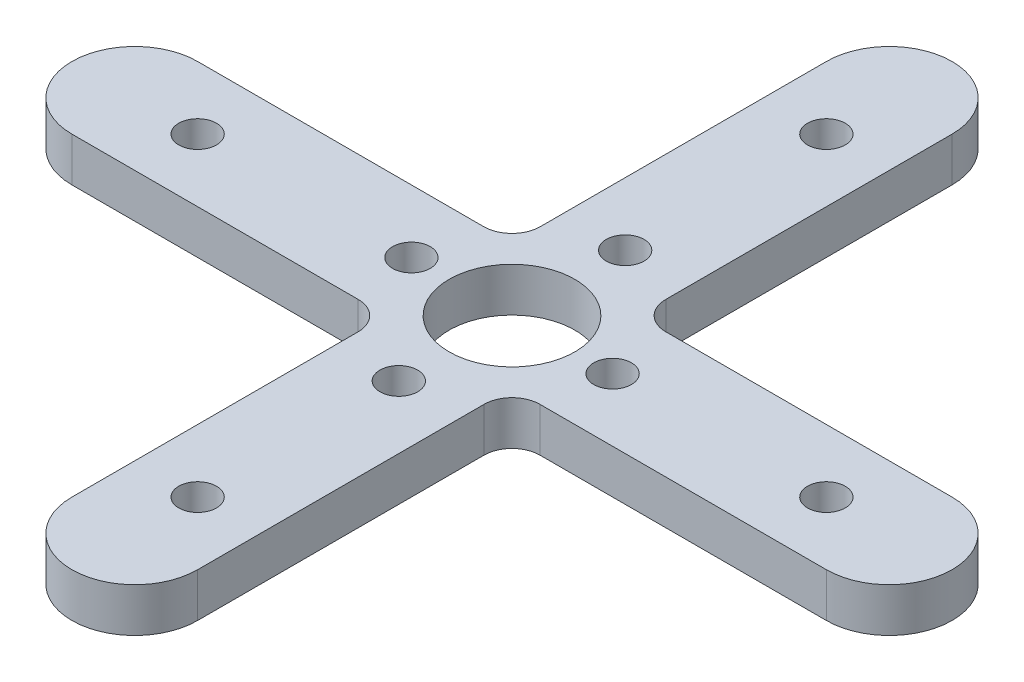
from build123d import *

# Parameters (mm, degrees)
CROQUIS1_R              = 1.5
CROQUIS1_R_2            = 5
SALIENTE_EXTRUIR2_DEPTH = 3.5


with BuildPart() as part:
    # Croquis1 → Saliente-Extruir2 (new body)
    with BuildSketch(Plane(origin=(0, 0, 0), x_dir=(1, 0, 0), z_dir=(0, 1, 0))):
        with BuildLine():
            Line((1.47572532, 11.484579709), (1.47572532, 3.695762793))
            ThreePointArc((1.47572532, 3.695762793), (0.818994747, 2.110274939), (-0.766493108, 1.453544366))
            Line((-0.766493108, 1.453544366), (-23.52427468, 1.453544366))
            ThreePointArc((-23.52427468, 1.453544366), (-28.52427468, -3.546455634), (-23.52427468, -8.546455634))
            Line((-23.52427468, -8.546455634), (-0.766493108, -8.546455634))
            ThreePointArc((-0.766493108, -8.546455634), (0.818994747, -9.203186206), (1.47572532, -10.788674061))
            Line((1.47572532, -10.788674061), (1.47572532, -18.577490976))
            Line((1.47572532, -18.577490976), (1.47572532, -33.546455634))
            ThreePointArc((1.47572532, -33.546455634), (6.47572532, -38.546455634), (11.47572532, -33.546455634))
            Line((11.47572532, -33.546455634), (11.47572532, -10.788674061))
            Line((11.47572532, -10.788674061), (11.47572532, -10.748363891))
            ThreePointArc((11.47572532, -10.748363891), (12.133603326, -9.190173106), (13.697697252, -8.546455634))
            Line((13.697697252, -8.546455634), (36.47572532, -8.546455634))
            ThreePointArc((36.47572532, -8.546455634), (41.47572532, -3.546455634), (36.47572532, 1.453544366))
            Line((36.47572532, 1.453544366), (13.697697252, 1.453544366))
            ThreePointArc((13.697697252, 1.453544366), (12.133603326, 2.097261838), (11.47572532, 3.655452623))
            Line((11.47572532, 3.655452623), (11.47572532, 3.695762793))
            Line((11.47572532, 3.695762793), (11.47572532, 26.453544366))
            ThreePointArc((11.47572532, 26.453544366), (6.47572532, 31.453544366), (1.47572532, 26.453544366))
            Line((1.47572532, 26.453544366), (1.47572532, 11.484579709))
        make_face()
        with Locations(Location((-1.52427468, -3.546455634, 0), (0, 0, 270))):
            Circle(CROQUIS1_R, mode=Mode.SUBTRACT)
        with Locations(Location((6.47572532, -28.546455634, 0), (0, 0, 270))):
            Circle(CROQUIS1_R, mode=Mode.SUBTRACT)
        with Locations(Location((6.47572532, -12.546455634, 0), (0, 0, 270))):
            Circle(CROQUIS1_R, mode=Mode.SUBTRACT)
        with Locations(Location((-18.52427468, -3.546455634, 0), (0, 0, 270))):
            Circle(CROQUIS1_R, mode=Mode.SUBTRACT)
        with Locations(Location((6.47572532, -3.546455634, 0), (0, 0, 270))):
            Circle(CROQUIS1_R_2, mode=Mode.SUBTRACT)
        with Locations(Location((14.47572532, -3.546455634, 0), (0, 0, 270))):
            Circle(CROQUIS1_R, mode=Mode.SUBTRACT)
        with Locations(Location((6.47572532, 5.453544366, 0), (0, 0, 270))):
            Circle(CROQUIS1_R, mode=Mode.SUBTRACT)
        with Locations(Location((31.47572532, -3.546455634, 0), (0, 0, 270))):
            Circle(CROQUIS1_R, mode=Mode.SUBTRACT)
        with Locations(Location((6.47572532, 21.453544366, 0), (0, 0, 270))):
            Circle(CROQUIS1_R, mode=Mode.SUBTRACT)
    extrude(amount=SALIENTE_EXTRUIR2_DEPTH)


solid = part.part
